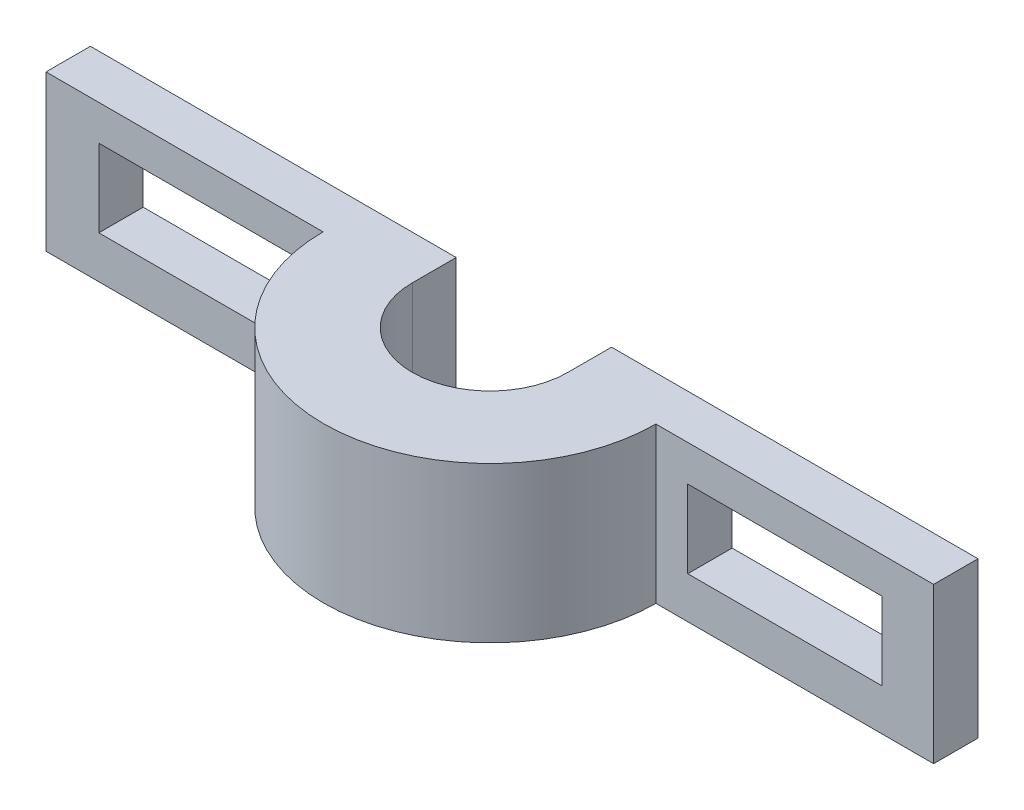
from build123d import *

# Parameters (mm, degrees)
SKETCH_1_R          = 7.5
EXTRUDE_4_DEPTH     = 7
SKETCH_4_W          = 40
SKETCH_4_H          = 2
EXTRUDE_5_DEPTH     = 7
SKETCH_5_W          = 16.420397205
SKETCH_5_H          = 7.153518057
CUT_EXTRUDE_1_DEPTH = 7
SKETCH_6_R          = 5.50001496
CUT_EXTRUDE_2_DEPTH = 7
SKETCH_7_W          = 11.00002992
SKETCH_7_H          = 1.975158718
CUT_EXTRUDE_3_DEPTH = 7
SKETCH_9_W          = 9.755837775
SKETCH_9_H          = 3.5
SKETCH_9_W_2        = 9.755837774
CUT_EXTRUDE_4_DEPTH = 7
SKETCH_10_W         = 1
SKETCH_10_H         = 3.5
EXTRUDE_6_DEPTH     = 2
SKETCH_11_W         = 1
SKETCH_11_H         = 3.5
EXTRUDE_7_DEPTH     = 2
SKETCH_12_R         = 5.944171322
EXTRUDE_8_DEPTH     = 7
SKETCH_13_W         = 14.038978355
SKETCH_13_H         = 4.452309985
CUT_EXTRUDE_5_DEPTH = 7
SKETCH_14_R         = 3.5
CUT_EXTRUDE_6_DEPTH = 7
SKETCH_15_W         = 7
SKETCH_15_H         = 1.975158718
CUT_EXTRUDE_7_DEPTH = 7


with BuildPart() as part:
    # 草图1 → 凸台-拉伸4 (new body)
    with BuildSketch(Plane(origin=(0, 0, 0), x_dir=(1, 0, 0), z_dir=(0, 1, 0))):
        with Locations(Location((0, 0, 0), (0, 0, 270))):
            Circle(SKETCH_1_R)
    extrude(amount=EXTRUDE_4_DEPTH)

    # 草图4 → 凸台-拉伸5 (add)
    with BuildSketch(Plane.XZ):
        with Locations((0.014666229, -0.975158718)):
            Rectangle(SKETCH_4_W, SKETCH_4_H)
    extrude(amount=-EXTRUDE_5_DEPTH)

    # 草图5 → 切除-拉伸1 (cut)
    with BuildSketch(Plane(origin=(0, 0, 0), x_dir=(-1, 0, 0), z_dir=(0, -1, 0))):
        with Locations((-0.974955135, 5.551917747)):
            Rectangle(SKETCH_5_W, SKETCH_5_H)
    extrude(amount=-CUT_EXTRUDE_1_DEPTH, mode=Mode.SUBTRACT)

    # 草图6 → 切除-拉伸2 (cut)
    with BuildSketch(Plane.XZ):
        Circle(SKETCH_6_R)
    extrude(amount=-CUT_EXTRUDE_2_DEPTH, mode=Mode.SUBTRACT)

    # 草图7 → 切除-拉伸3 (cut)
    with BuildSketch(Plane(origin=(0, 7, 0), x_dir=(1, 0, 0), z_dir=(0, 1, 0))):
        with Locations((0, 0.987579359)):
            Rectangle(SKETCH_7_W, SKETCH_7_H)
    extrude(amount=-CUT_EXTRUDE_3_DEPTH, mode=Mode.SUBTRACT)

    # 草图9 → 切除-拉伸4 (cut)
    with BuildSketch(Plane.XY.offset(0.024841282)):
        with Locations((-13.727128122, 3.659671281)):
            Rectangle(SKETCH_9_W, SKETCH_9_H)
        with Locations((13.812208225, 3.62574666)):
            Rectangle(SKETCH_9_W_2, SKETCH_9_H)
    extrude(amount=-CUT_EXTRUDE_4_DEPTH, mode=Mode.SUBTRACT)

    # 草图10 → 凸台-拉伸6 (add)
    with BuildSketch(Plane.XY.offset(0.024841282)):
        with Locations((18.190127112, 3.62574666)):
            Rectangle(SKETCH_10_W, SKETCH_10_H)
    extrude(amount=-EXTRUDE_6_DEPTH)

    # 草图11 → 凸台-拉伸7 (add)
    with BuildSketch(Plane.XY.offset(0.024841282)):
        with Locations((-18.10504701, 3.659671281)):
            Rectangle(SKETCH_11_W, SKETCH_11_H)
    extrude(amount=-EXTRUDE_7_DEPTH)

    # 草图12 → 凸台-拉伸8 (add)
    with BuildSketch(Plane(origin=(0, 0, 0), x_dir=(-1, 0, 0), z_dir=(0, -1, 0))):
        Circle(SKETCH_12_R)
    extrude(amount=-EXTRUDE_8_DEPTH)

    # 草图13 → 切除-拉伸5 (cut)
    with BuildSketch(Plane(origin=(0, 0, 0), x_dir=(-1, 0, 0), z_dir=(0, -1, 0))):
        with Locations((-1.413071361, 4.201313711)):
            Rectangle(SKETCH_13_W, SKETCH_13_H)
    extrude(amount=-CUT_EXTRUDE_5_DEPTH, mode=Mode.SUBTRACT)

    # 草图14 → 切除-拉伸6 (cut)
    with BuildSketch(Plane.XZ):
        Circle(SKETCH_14_R)
    extrude(amount=-CUT_EXTRUDE_6_DEPTH, mode=Mode.SUBTRACT)

    # 草图15 → 切除-拉伸7 (cut)
    with BuildSketch(Plane.XZ):
        with Locations((0, -0.987579359)):
            Rectangle(SKETCH_15_W, SKETCH_15_H)
    extrude(amount=-CUT_EXTRUDE_7_DEPTH, mode=Mode.SUBTRACT)


solid = part.part
